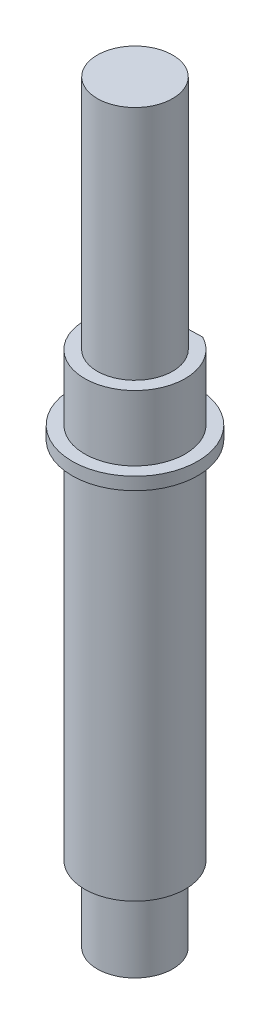
from build123d import *

# Parameters (mm, degrees)
SKETCH_1_R      = 1.5
EXTRUDE_1_DEPTH = 30
EXTRUDE_START   = 15
SKETCH_2_R      = 2
SKETCH_2_R_2    = 1.5
EXTRUDE_2_DEPTH = 15
SKETCH_3_R      = 1.5
EXTRUDE_3_DEPTH = 2.6
EXTRUDE_START_2 = -0.5
SKETCH_4_R      = 2.5
SKETCH_4_R_2    = 2
EXTRUDE_4_DEPTH = 0.5


with BuildPart() as part:
    # 草图1 → 凸台-拉伸1 (new body)
    with BuildSketch(Plane(origin=(0, 0, 0), x_dir=(1, 0, 0), z_dir=(0, 1, 0))):
        with Locations(Location((0, 0, 0), (0, 0, 270))):
            Circle(SKETCH_1_R)
    extrude(amount=EXTRUDE_1_DEPTH)

    # 草图2 → 凸台-拉伸2 (add)
    with BuildSketch(Plane(origin=(0, 18, 0), x_dir=(-1, 0, 0), z_dir=(0, -1, 0)).offset(EXTRUDE_START)):
        with Locations(Location((0, 0, 0), (0, 0, 90))):
            Circle(SKETCH_2_R)
        with Locations(Location((0, 0, 0), (0, 0, 90))):
            Circle(SKETCH_2_R_2, mode=Mode.SUBTRACT)
    extrude(amount=-EXTRUDE_2_DEPTH)

    # 草图3 → 凸台-拉伸3 (add)
    with BuildSketch(Plane(origin=(0, 18, 0), x_dir=(1, 0, 0), z_dir=(0, 1, 0))):
        with BuildLine():
            Line((0.91625301, 1.777774007), (-1.022249701, 1.719012958))
            ThreePointArc((-1.022249701, 1.719012958), (0.060597358, -1.999081779), (0.91625301, 1.777774007))
        make_face()
        with Locations(Location((0, 0, 0), (0, 0, 90))):
            Circle(SKETCH_3_R, mode=Mode.SUBTRACT)
    extrude(amount=EXTRUDE_3_DEPTH)

    # 草图4 → 凸台-拉伸4 (add)
    with BuildSketch(Plane(origin=(0, 18, 0), x_dir=(1, 0, 0), z_dir=(0, 1, 0)).offset(EXTRUDE_START_2)):
        with Locations(Location((0, 0, 0), (0, 0, 270))):
            Circle(SKETCH_4_R)
        with Locations(Location((0, 0, 0), (0, 0, 270))):
            Circle(SKETCH_4_R_2, mode=Mode.SUBTRACT)
    extrude(amount=EXTRUDE_4_DEPTH)


solid = part.part
